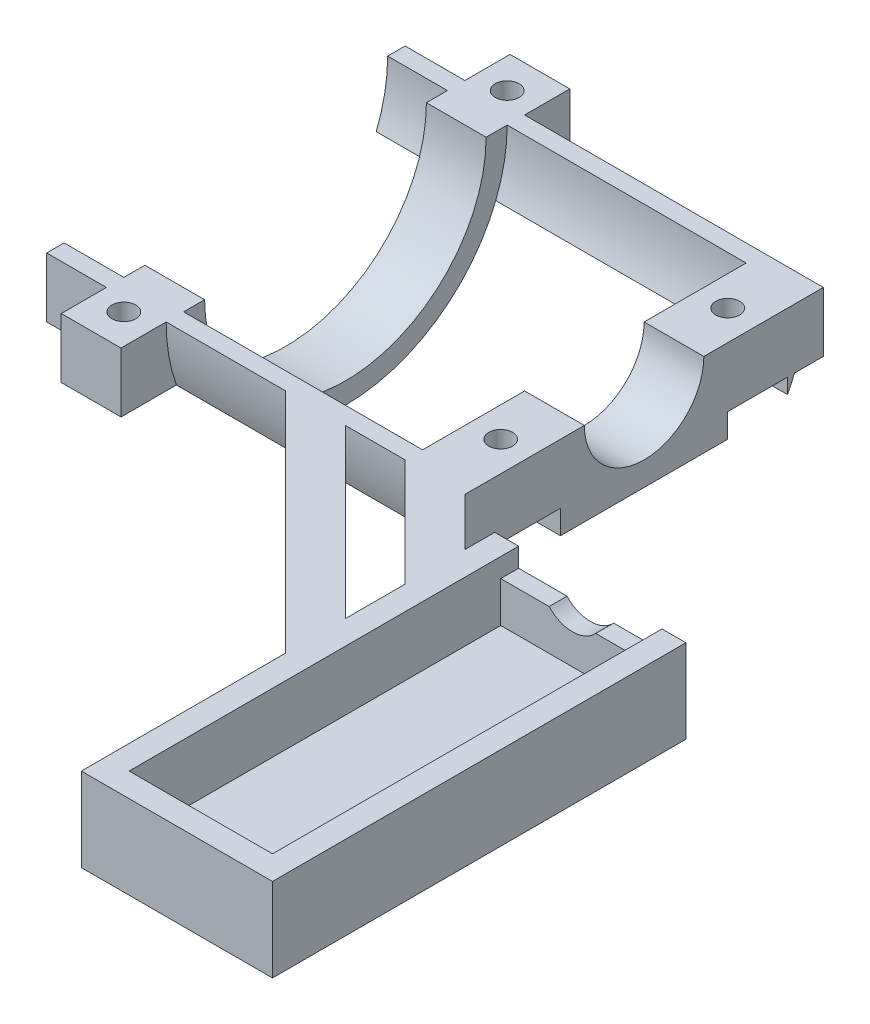
from build123d import *

# Parameters (mm, degrees)
BOSS_EXTRUDE1_DEPTH     = 35
BOSS_EXTRUDE2_START     = -5
BOSS_EXTRUDE2_DEPTH     = 5
BOSS_EXTRUDE3_START     = -5
BOSS_EXTRUDE3_DEPTH     = 5
CUT_EXTRUDE1_DEPTH      = 31.1
SKETCH10_W              = 5
SKETCH10_H              = 3.78
BOSS_EXTRUDE6_DEPTH     = 5
CUT_EXTRUDE4_START      = -10
CUT_EXTRUDE4_DEPTH      = 20
SKETCH12_R              = 1
CUT_EXTRUDE5_DEPTH      = 10
CUT_EXTRUDE11_DEPTH     = 2
SKETCH14_R              = 2.5
CUT_EXTRUDE12_DEPTH     = 2
BOSS_EXTRUDE7_START     = -2
SKETCH15_R              = 2
BOSS_EXTRUDE7_DEPTH     = 5
BOSS_EXTRUDE8_DEPTH     = 6
SKETCH18_W              = 32.6
SKETCH18_H              = 12
BOSS_EXTRUDE9_DEPTH     = 2
SKETCH19_W              = 32.6
SKETCH19_H              = 12
BOSS_EXTRUDE10_DEPTH    = 2
CUT_EXTRUDE13_DEPTH     = 64.083608013
BOSS_EXTRUDE12_START    = -5
BOSS_EXTRUDE12_DEPTH    = 5
SKETCH22_W              = 16
SKETCH22_H              = 32.6
CUT_EXTRUDE14_DEPTH     = 5
SKETCH23_R              = 2
CUT_EXTRUDE15_DEPTH     = 5
SKETCH24_W              = 23.178287832
SKETCH24_H              = 10
CUT_EXTRUDE_THIN1_DEPTH = 5
CUT_EXTRUDE16_DEPTH     = 5
SKETCH26_W              = 16
SKETCH26_H              = 7
BOSS_EXTRUDE13_DEPTH    = 2


with BuildPart() as part:
    # Sketch2 → Boss-Extrude1 (new body)
    with BuildSketch(Plane(origin=(0, 0, 0), x_dir=(0, 0, -1), z_dir=(1, 0, 0))):
        with BuildLine():
            Line((-15, 13.54), (-13.54, 13.54))
            ThreePointArc((-13.54, 13.54), (0, 0), (13.54, 13.54))
            Line((13.54, 13.54), (15, 13.54))
            Line((15, 13.54), (15, -1.46))
            Line((15, -1.46), (0, -1.46))
            Line((0, -1.46), (-15, -1.46))
            Line((-15, -1.46), (-15, 13.54))
        make_face()
    extrude(amount=BOSS_EXTRUDE1_DEPTH)

    # Sketch3 → Boss-Extrude2 (add)
    with BuildSketch(Plane(origin=(35, 0, 0), x_dir=(0, 0, -1), z_dir=(1, 0, 0)).offset(BOSS_EXTRUDE2_START)):
        with BuildLine():
            Line((-13.54, 13.54), (-5, 13.54))
            ThreePointArc((-5, 13.54), (0, 8.54), (5, 13.54))
            Line((5, 13.54), (13.54, 13.54))
            ThreePointArc((13.54, 13.54), (0, 0), (-13.54, 13.54))
        make_face()
    extrude(amount=BOSS_EXTRUDE2_DEPTH)

    # Sketch4 → Boss-Extrude3 (add)
    with BuildSketch(Plane.ZY.offset(BOSS_EXTRUDE3_START)):
        with BuildLine():
            Line((-13.54, 13.54), (-11.78, 13.54))
            ThreePointArc((-11.78, 13.54), (0, 1.76), (11.78, 13.54))
            Line((11.78, 13.54), (13.54, 13.54))
            ThreePointArc((13.54, 13.54), (0, 0), (-13.54, 13.54))
        make_face()
    extrude(amount=-BOSS_EXTRUDE3_DEPTH)

    # Sketch7 → Cut-Extrude1 (cut)
    with BuildSketch(Plane(origin=(0, 0, -15), x_dir=(-1, 0, 0), z_dir=(0, 0, -1))):
        with BuildLine():
            Line((-33.5, -1.74), (-39.5, -1.74))
            Line((-39.5, -1.74), (-39.5, 4.26))
            ThreePointArc((-39.5, 4.26), (-35.257359313, 2.502640687), (-33.5, -1.74))
        make_face()
    extrude(amount=-CUT_EXTRUDE1_DEPTH, mode=Mode.SUBTRACT)

    # Sketch10 → Boss-Extrude6 (add)
    with BuildSketch(Plane(origin=(0, 13.54, 0), x_dir=(1, 0, 0), z_dir=(0, 1, 0))):
        with Locations((7.5, -16.89)):
            Rectangle(SKETCH10_W, SKETCH10_H)
        with Locations((7.5, 16.89)):
            Rectangle(SKETCH10_W, SKETCH10_H)
    extrude(amount=-BOSS_EXTRUDE6_DEPTH)

    # Sketch11 → Cut-Extrude4 (cut)
    with BuildSketch(Plane.ZY.offset(CUT_EXTRUDE4_START)):
        with BuildLine():
            ThreePointArc((15, 13.54), (10.606601722, 2.933398287), (1.2e-08, -1.46))
            Line((1.2e-08, -1.46), (15, -1.46))
            Line((15, -1.46), (15, 13.54))
        make_face()
        with BuildLine():
            ThreePointArc((1.2e-08, -1.46), (-10.606601713, 2.933398278), (-15, 13.54))
            Line((-15, 13.54), (-15, -1.46))
            Line((-15, -1.46), (1.2e-08, -1.46))
        make_face()
    extrude(amount=-CUT_EXTRUDE4_DEPTH, mode=Mode.SUBTRACT)

    # Sketch12 → Cut-Extrude5 (cut)
    with BuildSketch(Plane(origin=(0, 13.54, 0), x_dir=(1, 0, 0), z_dir=(0, 1, 0))):
        with Locations(Location((7.5, -16.04, 0), (0, 0, 270))):
            Circle(SKETCH12_R)
        with Locations(Location((7.5, 16.04, 0), (0, 0, 270))):
            Circle(SKETCH12_R)
        with Locations(Location((32.5, -9.5, 0), (0, 0, 270))):
            Circle(SKETCH12_R)
        with Locations(Location((32.5, 9.5, 0), (0, 0, 270))):
            Circle(SKETCH12_R)
    extrude(amount=-CUT_EXTRUDE5_DEPTH, mode=Mode.SUBTRACT)

    # Sketch13 → Cut-Extrude11 (cut)
    with BuildSketch(Plane(origin=(0, 8.54, 0), x_dir=(1, 0, 0), z_dir=(0, 1, 0))):
        with BuildLine():
            Line((32.5, 12), (35, 12))
            Line((35, 12), (35.753860742, 12))
            Line((35.753860742, 12), (35.753860742, 7))
            Line((35.753860742, 7), (35, 7))
            Line((35, 7), (32.5, 7))
            ThreePointArc((32.5, 7), (31, 7.5), (30.1, 8.8))
            Line((30.1, 8.8), (30.1, 9.5))
            Line((30.1, 9.5), (30.1, 10.2))
            ThreePointArc((30.1, 10.2), (31, 11.5), (32.5, 12))
        make_face()
        with BuildLine():
            Line((32.5, -7), (35, -7))
            Line((35, -7), (35.753860742, -7))
            Line((35.753860742, -7), (35.753860742, -12))
            Line((35.753860742, -12), (32.5, -12))
            ThreePointArc((32.5, -12), (31, -11.5), (30.1, -10.2))
            Line((30.1, -10.2), (30.1, -9.5))
            Line((30.1, -9.5), (30.1, -8.8))
            ThreePointArc((30.1, -8.8), (31, -7.5), (32.5, -7))
        make_face()
    extrude(amount=-CUT_EXTRUDE11_DEPTH, mode=Mode.SUBTRACT)

    # Sketch14 → Cut-Extrude12 (cut)
    with BuildSketch(Plane.XZ.offset(-8.54)):
        with Locations((7.5, 16.04)):
            Circle(SKETCH14_R)
        with Locations((7.5, -16.04)):
            Circle(SKETCH14_R)
    extrude(amount=CUT_EXTRUDE12_DEPTH, mode=Mode.SUBTRACT)

    # Sketch20 → Cut-Extrude13 (cut, through all)
    with BuildSketch(Plane(origin=(35, 0, 0), x_dir=(0, 0, -1), z_dir=(1, 0, 0))):
        with BuildLine():
            Line((15, 8.54), (12.582988516, 8.54))
            ThreePointArc((12.582988516, 8.54), (0.000990149, 0.000672008), (-12.581008218, 8.54))
            Line((-12.581008218, 8.54), (-15, 8.54))
            Line((-15, 8.54), (-15, -1.46))
            Line((-15, -1.46), (15, -1.46))
            Line((15, -1.46), (15, 8.54))
        make_face()
    extrude(amount=-CUT_EXTRUDE13_DEPTH, mode=Mode.SUBTRACT)



with BuildPart() as body_2:
    # Sketch15 → Boss-Extrude7 (new body)
    with BuildSketch(Plane(origin=(0, 0, 0), x_dir=(-1, 0, 0), z_dir=(0, 0, -1)).offset(BOSS_EXTRUDE7_START)):
        with Locations((-47.000109969, 13.54)):
            Circle(SKETCH15_R)
    extrude(amount=-BOSS_EXTRUDE7_DEPTH)

    # Sketch23 → Cut-Extrude15 (cut)
    with BuildSketch(Plane(origin=(0, 0, 2), x_dir=(-1, 0, 0), z_dir=(0, 0, -1))):
        with Locations((-47.000109969, 13.54)):
            Circle(SKETCH23_R)
    extrude(amount=-CUT_EXTRUDE15_DEPTH, mode=Mode.SUBTRACT)


with BuildPart() as body_3:
    # Sketch16 → Boss-Extrude8 (new, symmetric)
    with BuildSketch(Plane(origin=(47, 0, 0), x_dir=(0, 0, -1), z_dir=(1, 0, 0))):
        Polygon((-18, 11.94), (-18, 8.54), (-49.1, 8.54), (-49.1, 6.54), (-16.5, 6.54), (-16.5, 11.94), align=None)
    extrude(amount=BOSS_EXTRUDE8_DEPTH, both=True)

    # Sketch18 → Boss-Extrude9 (add)
    with BuildSketch(Plane.ZY.offset(-41)):
        with Locations((32.8, 12.54)):
            Rectangle(SKETCH18_W, SKETCH18_H)
    extrude(amount=BOSS_EXTRUDE9_DEPTH)

    # Sketch19 → Boss-Extrude10 (add)
    with BuildSketch(Plane(origin=(53, 0, 0), x_dir=(0, 0, -1), z_dir=(1, 0, 0))):
        with Locations((-32.8, 12.54)):
            Rectangle(SKETCH19_W, SKETCH19_H)
    extrude(amount=BOSS_EXTRUDE10_DEPTH)


with BuildPart() as part_1:
    add(part.part)

    add(body_3.part)  # Boss-Extrude12 merges body 3
    # Sketch21 → Boss-Extrude12 (add)
    with BuildSketch(Plane(origin=(0, 13.54, 0), x_dir=(1, 0, 0), z_dir=(0, 1, 0)).offset(BOSS_EXTRUDE12_START)):
        Polygon((35, -15), (39, -19), (39, -24), (30, -15), align=None)
        Polygon((25, -15), (39, -29), (39, -34), (20, -15), (19.142135624, -14.142135624), (24.142135624, -14.142135624), align=None)
    extrude(amount=BOSS_EXTRUDE12_DEPTH)

    # Sketch22 → Cut-Extrude14 (cut)
    with BuildSketch(Plane(origin=(0, 13.54, 0), x_dir=(1, 0, 0), z_dir=(0, 1, 0))):
        with Locations((47, -32.8)):
            Rectangle(SKETCH22_W, SKETCH22_H)
    extrude(amount=CUT_EXTRUDE14_DEPTH, mode=Mode.SUBTRACT)

    # Sketch24 → Cut-Extrude-Thin1 (cut)
    with BuildSketch(Plane(origin=(35, 0, 0), x_dir=(0, 0, -1), z_dir=(1, 0, 0))):
        with Locations((0.000990149, 1.54)):
            Rectangle(SKETCH24_W, SKETCH24_H)
        with BuildLine():
            ThreePointArc((-11.587661518, 6.54), (0, 0.002130911), (11.587661518, 6.54))
            Line((11.587661518, 6.54), (20.14710425, 1.369319183))
            ThreePointArc((20.14710425, 1.369319183), (0, -9.997869089), (-20.14710425, 1.369319183))
            Line((-20.14710425, 1.369319183), (-11.587661518, 6.54))
        make_face()
    extrude(amount=-CUT_EXTRUDE_THIN1_DEPTH, mode=Mode.SUBTRACT)

    # Sketch25 → Cut-Extrude16 (cut)
    with BuildSketch(Plane.XY.offset(18)):
        with BuildLine():
            Line((45.047915657, 11.94), (48.952084343, 11.94))
            ThreePointArc((48.952084343, 11.94), (47, 11.083618243), (45.047915657, 11.94))
        make_face()
    extrude(amount=-CUT_EXTRUDE16_DEPTH, mode=Mode.SUBTRACT)

    # Sketch26 → Boss-Extrude13 (add)
    with BuildSketch(Plane.XY.offset(49.1)):
        with Locations((47, 10.04)):
            Rectangle(SKETCH26_W, SKETCH26_H)
    extrude(amount=BOSS_EXTRUDE13_DEPTH)


solid = part_1.part
